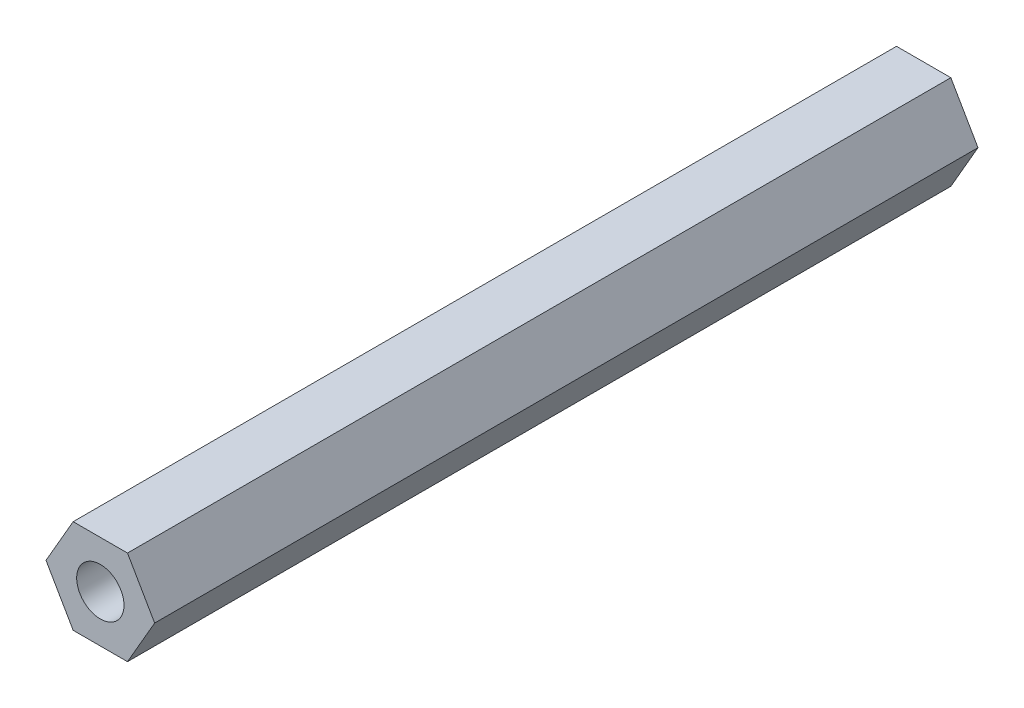
from build123d import *

# Parameters (mm, degrees)
F_70MM_DEPTH           = 70
SKETCH_M4_R            = 2.01
CUT_EXTRUDE_M4_DEPTH   = 10
CUT_EXTRUDE_START      = -10
SKETCH_M4_2_R          = 2.01
CUT_EXTRUDE_M4_2_DEPTH = 10


with BuildPart() as part:
    # Sketch 185 → 隔柱高度_70mm (new body)
    with BuildSketch(Plane.XY):
        Polygon((4.618802154, 0), (2.309401077, 4), (-2.309401077, 4), (-4.618802154, 0), (-2.309401077, -4), (2.309401077, -4), align=None)
    extrude(amount=F_70MM_DEPTH)

    # Sketch M4 → Cut-Extrude M4 (cut)
    with BuildSketch(Plane(origin=(0, 0, 0), x_dir=(-1, 0, 0), z_dir=(0, 0, -1))):
        Circle(SKETCH_M4_R)
    extrude(amount=-CUT_EXTRUDE_M4_DEPTH, mode=Mode.SUBTRACT)

    # Sketch M4 2 → Cut-Extrude M4 2 (cut)
    with BuildSketch(Plane.XY.offset(70).offset(CUT_EXTRUDE_START)):
        with Locations(Location((0, 0, 0), (0, 0, 180))):
            Circle(SKETCH_M4_2_R)
    extrude(amount=CUT_EXTRUDE_M4_2_DEPTH, mode=Mode.SUBTRACT)


solid = part.part
